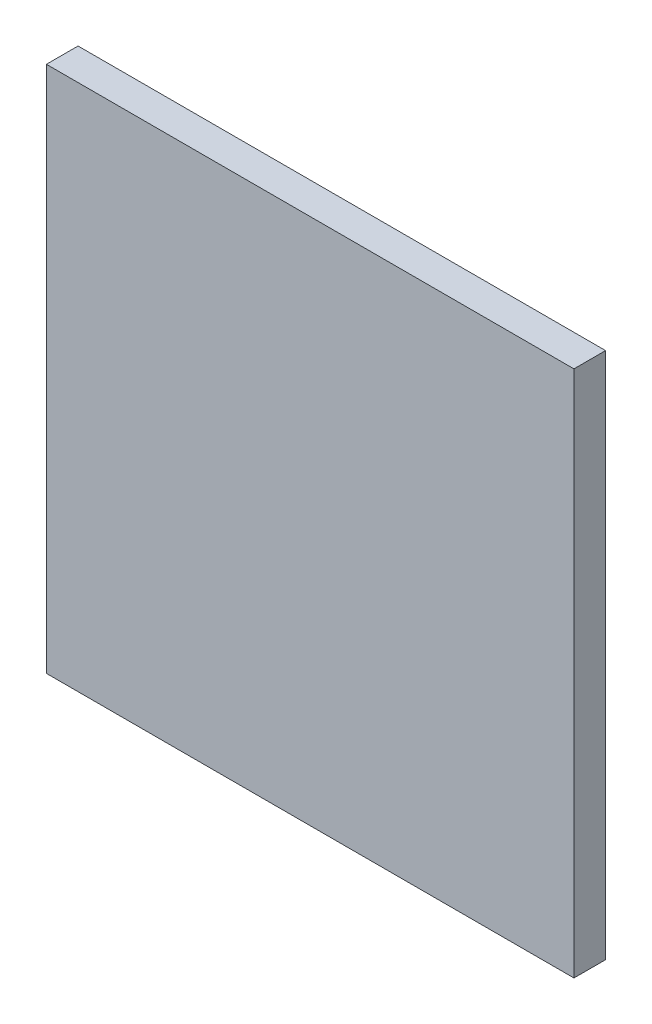
from build123d import *

# Parameters (mm, degrees)
CROQUIS1_W              = 5000
CROQUIS1_H              = 5000
SALIENTE_EXTRUIR1_DEPTH = 300


with BuildPart() as part:
    # Croquis1 → Saliente-Extruir1 (new body)
    with BuildSketch(Plane.XY):
        with Locations((2500, 2500)):
            Rectangle(CROQUIS1_W, CROQUIS1_H)
    extrude(amount=SALIENTE_EXTRUIR1_DEPTH)


solid = part.part
